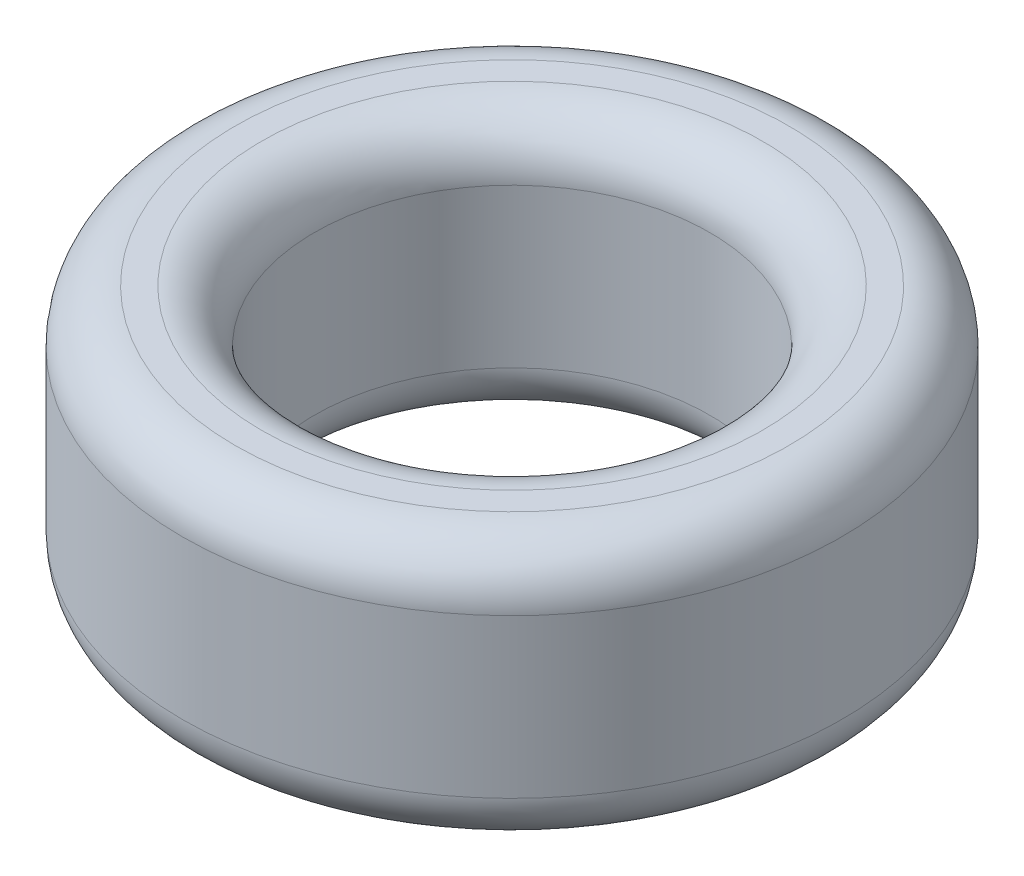
from build123d import *

# Parameters (mm, degrees)
SKETCH1_R           = 12.5
BOSS_EXTRUDE1_DEPTH = 10
SKETCH2_R           = 7.5
CUT_EXTRUDE1_DEPTH  = 21.310096012
FILLET1_R           = 2


with BuildPart() as part:
    # Sketch1 → Boss-Extrude1 (new body)
    with BuildSketch(Plane(origin=(0, 0, 0), x_dir=(1, 0, 0), z_dir=(0, 1, 0))):
        with Locations(Location((0, 0, 0), (0, 0, 270))):
            Circle(SKETCH1_R)
    extrude(amount=BOSS_EXTRUDE1_DEPTH)

    # Sketch2 → Cut-Extrude1 (cut, through all)
    with BuildSketch(Plane(origin=(0, 10, 0), x_dir=(1, 0, 0), z_dir=(0, 1, 0))):
        with Locations(Location((0, 0, 0), (0, 0, 270))):
            Circle(SKETCH2_R)
    extrude(amount=-CUT_EXTRUDE1_DEPTH, mode=Mode.SUBTRACT)

    # Fillet1
    fillet1_edges = [part.edges().sort_by_distance(p)[0] for p in [
        (0, 0, -12.5),
        (0, 10, -12.5),
        (0, 0, -7.5),
        (0, 10, -7.5),
    ]]
    fillet(fillet1_edges, radius=FILLET1_R)


solid = part.part
